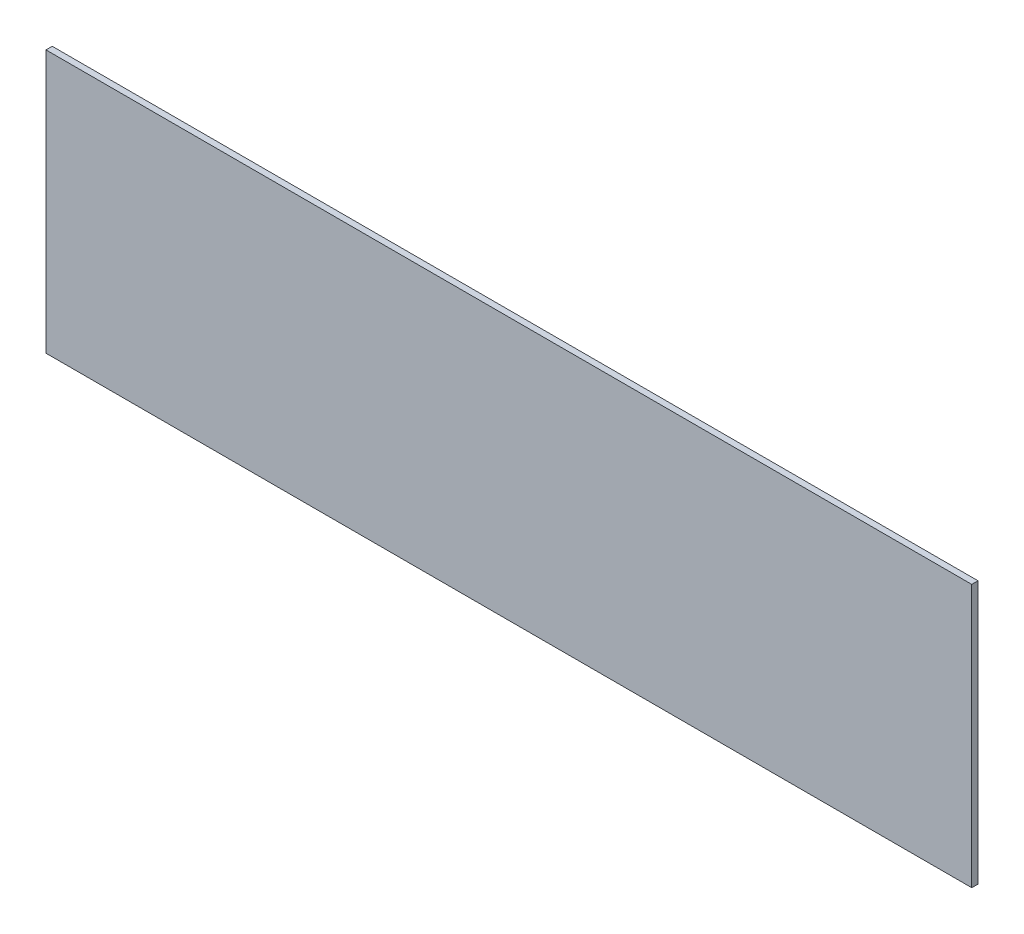
from build123d import *

# Parameters (mm, degrees)
SKETCH1_W           = 469.9
SKETCH1_H           = 133.35
BOSS_EXTRUDE1_DEPTH = 3.175


with BuildPart() as part:
    # Sketch1 → Boss-Extrude1 (new body)
    with BuildSketch(Plane.XY):
        Rectangle(SKETCH1_W, SKETCH1_H)
    extrude(amount=BOSS_EXTRUDE1_DEPTH)


solid = part.part
